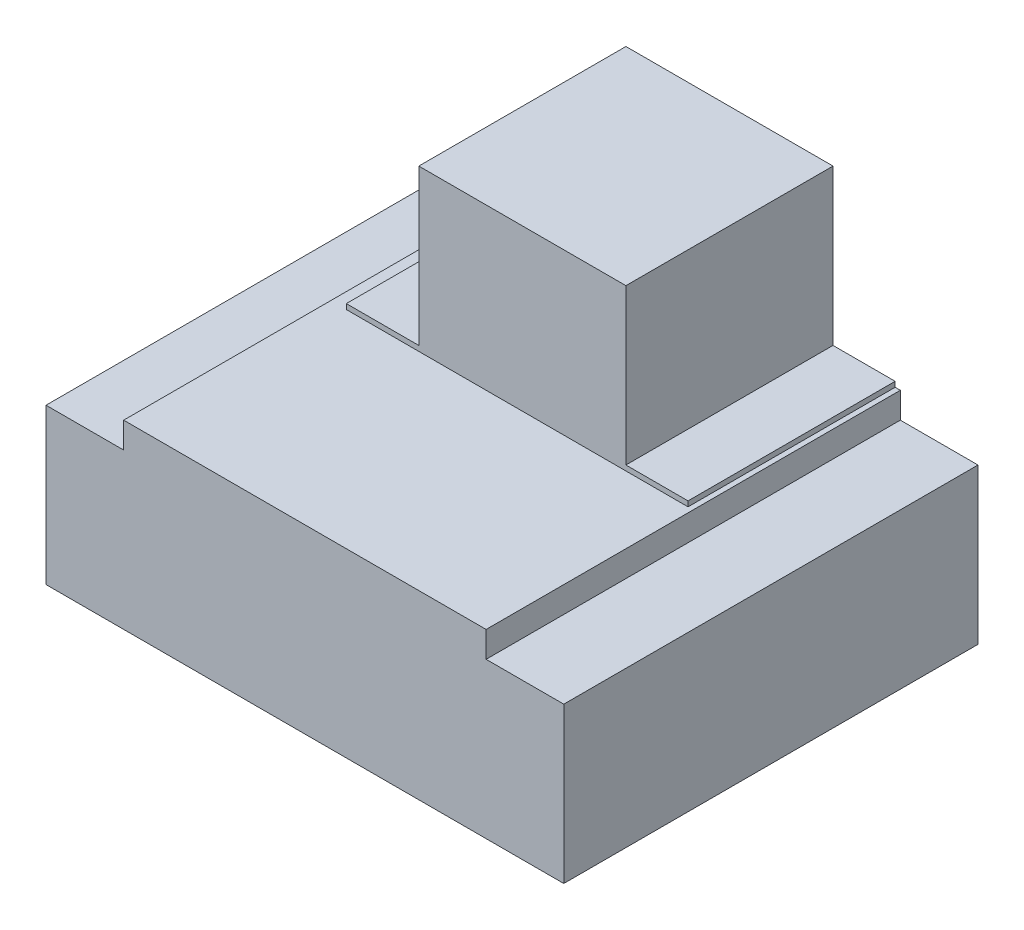
from build123d import *

# Parameters (mm, degrees)
SKETCH_1_W          = 100
SKETCH_1_H          = 80
EXTRUDE_1_DEPTH     = 35
SKETCH_2_W          = 66
SKETCH_2_H          = 40
EXTRUDE_2_DEPTH     = 1
SKETCH_3_W          = 40
SKETCH_3_H          = 40
EXTRUDE_3_DEPTH     = 30
SKETCH_4_W          = 15
SKETCH_4_H          = 80
CUT_EXTRUDE_1_DEPTH = 5


with BuildPart() as part:
    # 草图1 → 凸台-拉伸1 (new body)
    with BuildSketch(Plane(origin=(0, 0, 0), x_dir=(1, 0, 0), z_dir=(0, 1, 0))):
        with Locations((50, 40)):
            Rectangle(SKETCH_1_W, SKETCH_1_H)
    extrude(amount=EXTRUDE_1_DEPTH)

    # 草图2 → 凸台-拉伸2 (add)
    with BuildSketch(Plane(origin=(0, 35, 0), x_dir=(1, 0, 0), z_dir=(0, 1, 0))):
        with Locations((51, 60)):
            Rectangle(SKETCH_2_W, SKETCH_2_H)
    extrude(amount=EXTRUDE_2_DEPTH)

    # 草图3 → 凸台-拉伸3 (add)
    with BuildSketch(Plane(origin=(0, 36, 0), x_dir=(1, 0, 0), z_dir=(0, 1, 0))):
        with Locations((52, 60)):
            Rectangle(SKETCH_3_W, SKETCH_3_H)
    extrude(amount=EXTRUDE_3_DEPTH)

    # 草图4 → 切除-拉伸1 (cut)
    with BuildSketch(Plane(origin=(0, 35, 0), x_dir=(1, 0, 0), z_dir=(0, 1, 0))):
        with Locations((7.5, 40)):
            Rectangle(SKETCH_4_W, SKETCH_4_H)
        with Locations((92.5, 40)):
            Rectangle(SKETCH_4_W, SKETCH_4_H)
    extrude(amount=-CUT_EXTRUDE_1_DEPTH, mode=Mode.SUBTRACT)


solid = part.part
